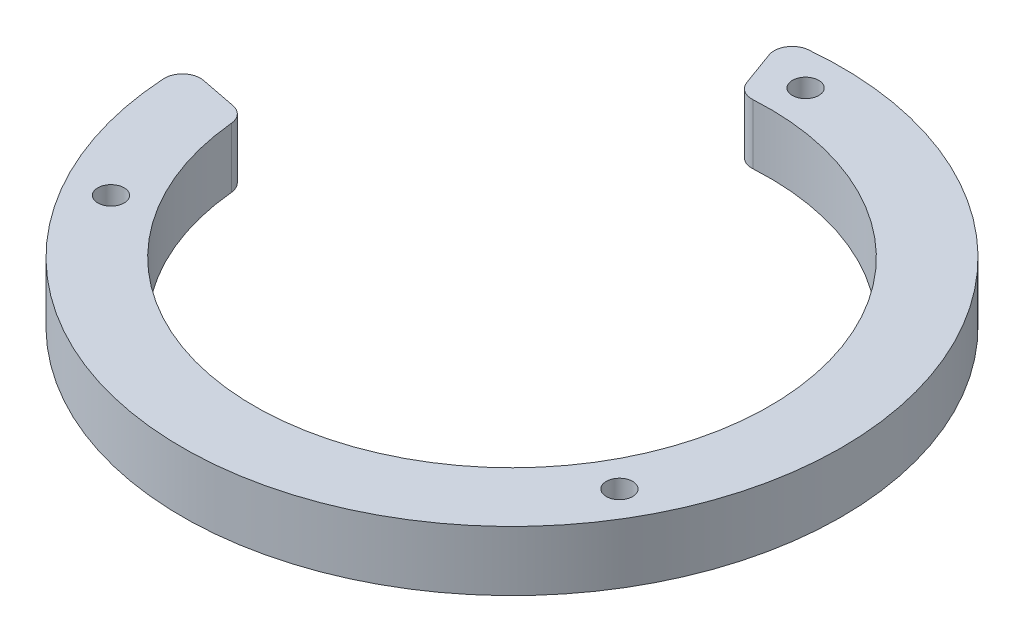
from build123d import *

# Parameters (mm, degrees)
SKETCH_1_R          = 27.5
SKETCH_1_R_2        = 21.5
SKETCH_1_R_3        = 1.1
EXTRUDE_1_DEPTH     = 5
CUT_EXTRUDE_1_DEPTH = 5
FILLET_1_R          = 1.5


with BuildPart() as part:
    # 草图1 → 凸台-拉伸1 (new body)
    with BuildSketch(Plane(origin=(0, 0, 0), x_dir=(1, 0, 0), z_dir=(0, 1, 0))):
        with Locations(Location((0, 0, 0), (0, 0, 270))):
            Circle(SKETCH_1_R)
        with Locations(Location((0, 0, 0), (0, 0, 270))):
            Circle(SKETCH_1_R_2, mode=Mode.SUBTRACT)
        with Locations(Location((0, 24.5, 0), (0, 0, 270))):
            Circle(SKETCH_1_R_3, mode=Mode.SUBTRACT)
        with Locations(Location((21.217622393, -12.25, 0), (0, 0, 270))):
            Circle(SKETCH_1_R_3, mode=Mode.SUBTRACT)
        with Locations(Location((-21.217622393, -12.25, 0), (0, 0, 270))):
            Circle(SKETCH_1_R_3, mode=Mode.SUBTRACT)
    extrude(amount=EXTRUDE_1_DEPTH)

    # 草图2 → 切除-拉伸1 (cut)
    with BuildSketch(Plane.XZ):
        with BuildLine():
            Line((-2.453357197, -21.359565503), (-4.550320626, -27.120925172))
            ThreePointArc((-4.550320626, -27.120925172), (-20.900792824, -17.871957345), (-27.498537849, -0.283577443))
            Line((-27.498537849, -0.283577443), (-21.481435012, 0.89328037))
            ThreePointArc((-21.481435012, 0.89328037), (-16.340619844, -13.972621197), (-2.453357197, -21.359565503))
        make_face()
    extrude(amount=-CUT_EXTRUDE_1_DEPTH, mode=Mode.SUBTRACT)

    # 圆角1
    fillet_1_edges = [part.edges().sort_by_distance(p)[0] for p in [
        (-21.481435012, 2.5, 0.89328037),
        (-2.453357197, 2.5, -21.359565503),
        (-4.550320626, 2.5, -27.120925172),
        (-27.498537849, 2.5, -0.283577443),
    ]]
    fillet(fillet_1_edges, radius=FILLET_1_R)


solid = part.part
